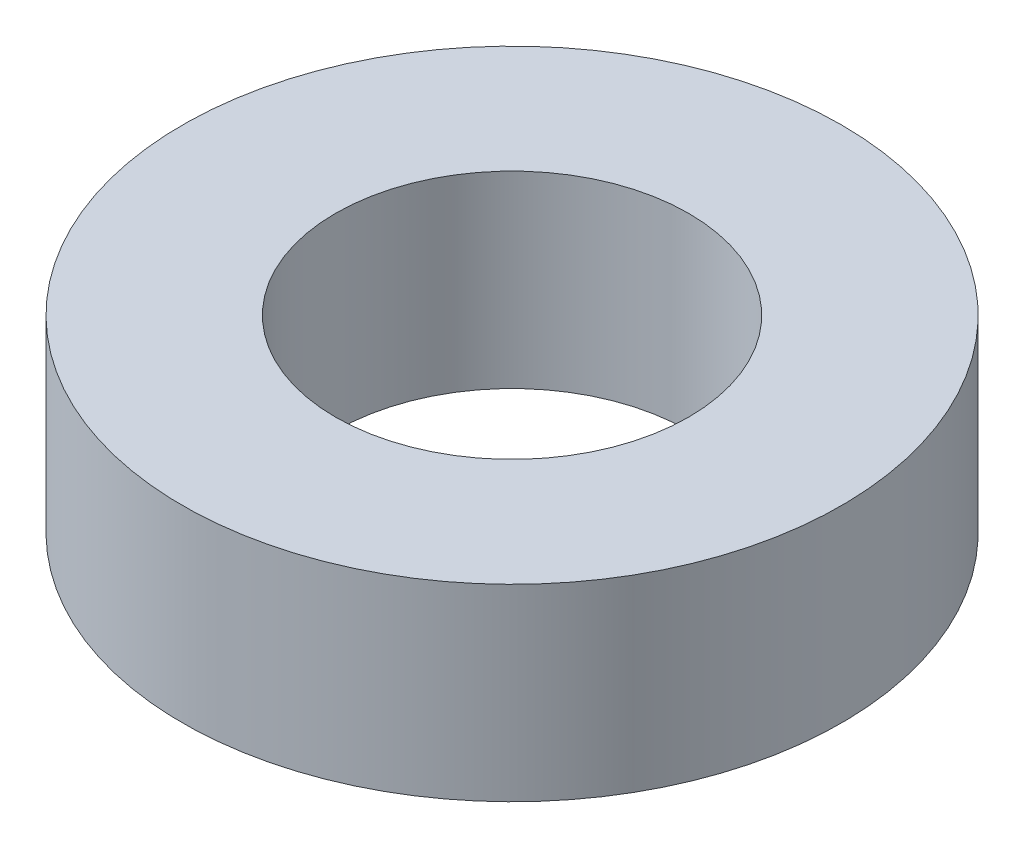
from build123d import *

# Parameters (mm, degrees)
SKETCH1_W = 6.5
SKETCH1_H = 8


with BuildPart() as part:
    # Sketch1 → Revolve1 (revolve)
    with BuildSketch(Plane.XY, mode=Mode.PRIVATE) as revolve1_sk:
        with Locations((10.75, 4)):
            Rectangle(SKETCH1_W, SKETCH1_H)
    revolve(revolve1_sk.sketch.rotate(Axis((0, -5.681392059, 0), (0, 1, 0)), 90), axis=Axis((0, -5.681392059, 0), (0, 1, 0)))


solid = part.part
